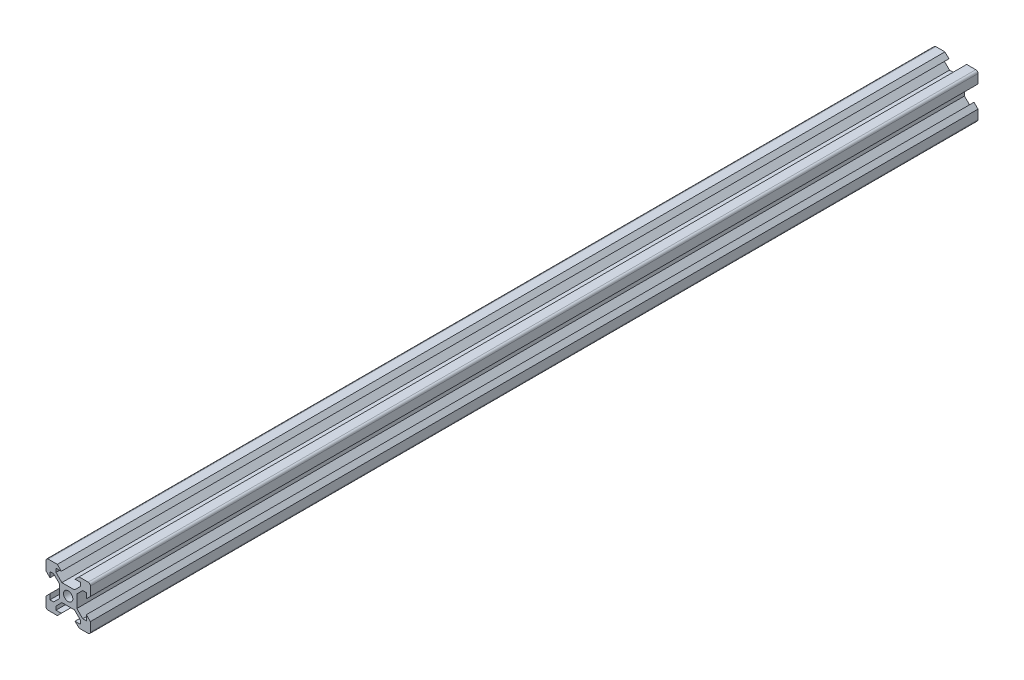
from build123d import *

# Parameters (mm, degrees)
SKETCH2_W           = 20
SKETCH2_H           = 20
BOSS_EXTRUDE1_DEPTH = 400
CUT_EXTRUDE1_DEPTH  = 401.249921924
CIRPATTERN2_COUNT   = 4
SKETCH9_R           = 2.1
CUT_EXTRUDE2_DEPTH  = 401.249921924
FILLET1_R           = 1


with BuildPart() as part:
    # Sketch2 → Boss-Extrude1 (new body)
    with BuildSketch(Plane.XY):
        Rectangle(SKETCH2_W, SKETCH2_H)
    extrude(amount=-BOSS_EXTRUDE1_DEPTH)

    # Sketch3 → Cut-Extrude1 (cut, symmetric)
    with BuildSketch(Plane.XY):
        Polygon((-3.1, 8.2), (-4.9, 10), (4.9, 10), (3.1, 8.2), (5.5, 8.2), (5.5, 6.56), (2.84, 3.9), (-2.84, 3.9), (-5.5, 6.56), (-5.5, 8.2), align=None)
    cut_extrude1 = extrude(amount=CUT_EXTRUDE1_DEPTH, both=True, mode=Mode.SUBTRACT)

    # CirPattern2: Cut-Extrude1 ×4 about axis
    cirpattern2_axis = Axis((0, 0, 0), (0, 0, 1))
    for i in range(1, CIRPATTERN2_COUNT):
        add(cut_extrude1.rotate(cirpattern2_axis, i * 360 / CIRPATTERN2_COUNT), mode=Mode.SUBTRACT)

    # Sketch9 → Cut-Extrude2 (cut, through all)
    with BuildSketch(Plane.XY):
        Circle(SKETCH9_R)
    extrude(amount=-CUT_EXTRUDE2_DEPTH, mode=Mode.SUBTRACT)

    # Fillet1
    fillet1_edges = [part.edges().sort_by_distance(p)[0] for p in [
        (-10, 10, -200),
        (10, 10, -200),
        (10, -10, -200),
        (-10, -10, -200),
    ]]
    fillet(fillet1_edges, radius=FILLET1_R)


solid = part.part
